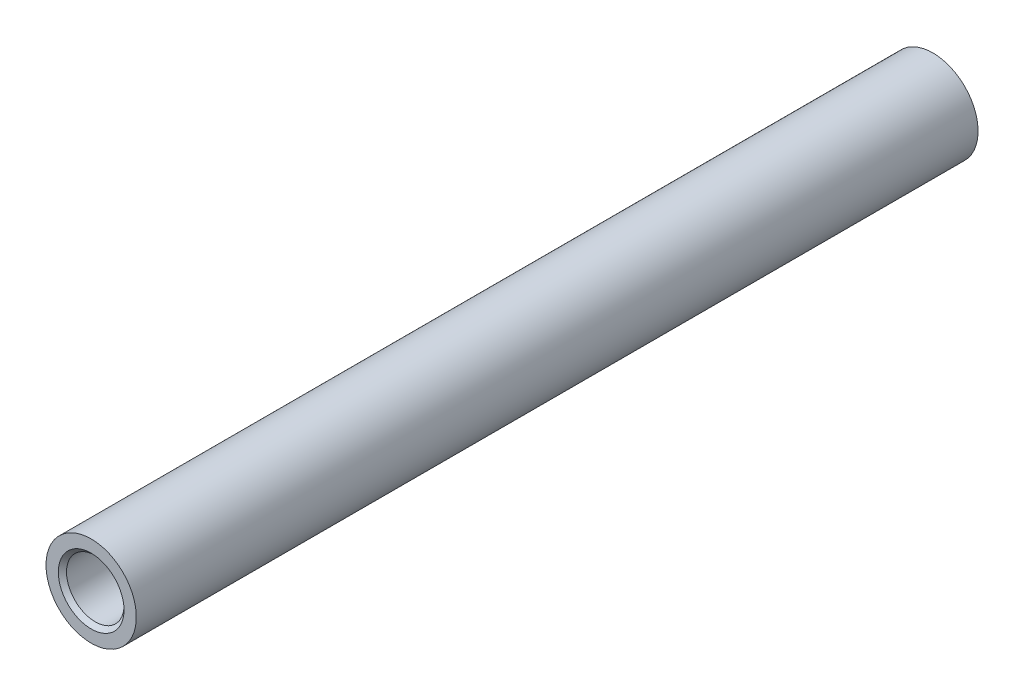
from build123d import *

# Parameters (mm, degrees)
SZKIC1_R                    = 11
SZKIC1_R_2                  = 7
DODANIE_WYCI_GNI_CIE1_DEPTH = 102.5
SZKIC2_R                    = 8
WYTNIJ_WYCI_GNI_CIE1_DEPTH  = 50
SFAZOWANIE1_SIZE            = 1


with BuildPart() as part:
    # Szkic1 → Dodanie-wyciągnięcie1 (new, symmetric)
    with BuildSketch(Plane.XY):
        with Locations(Location((0, 0, 0), (0, 0, 180))):
            Circle(SZKIC1_R)
        with Locations(Location((0, 0, 0), (0, 0, 180))):
            Circle(SZKIC1_R_2, mode=Mode.SUBTRACT)
    extrude(amount=DODANIE_WYCI_GNI_CIE1_DEPTH, both=True)

    # Szkic2 → Wytnij-wyciągnięcie1 (cut)
    with BuildSketch(Plane(origin=(0, 0, -102.5), x_dir=(-1, 0, 0), z_dir=(0, 0, -1))):
        Circle(SZKIC2_R)
    extrude(amount=-WYTNIJ_WYCI_GNI_CIE1_DEPTH, mode=Mode.SUBTRACT)

    # Sfazowanie1
    sfazowanie1_edges = [part.edges().sort_by_distance(p)[0] for p in [
        (7, 0, 102.5),
    ]]
    chamfer(sfazowanie1_edges, length=SFAZOWANIE1_SIZE)


solid = part.part
